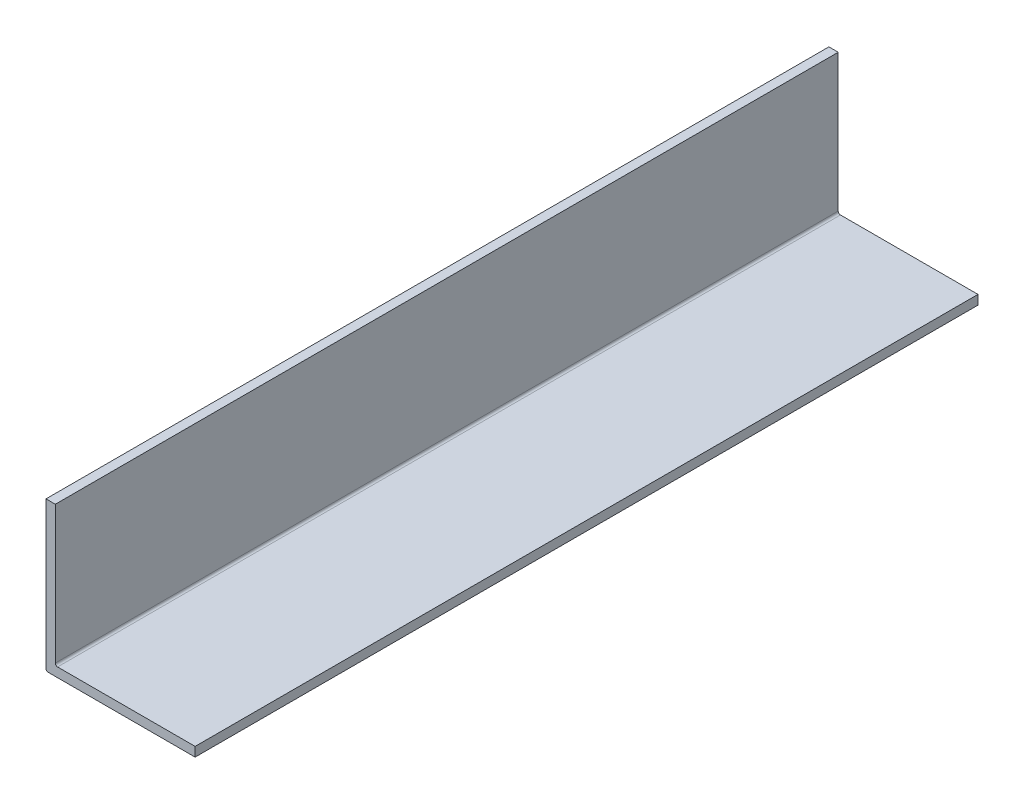
from build123d import *

# Parameters (mm, degrees)
BOSS_EXTRUDE1_DEPTH = 266.7


with BuildPart() as part:
    # Sketch1 → Boss-Extrude1 (new body)
    with BuildSketch(Plane.XY):
        with BuildLine():
            Line((3.175, 50.8), (3.175, 3.937))
            ThreePointArc((3.175, 3.937), (3.398184633, 3.398184633), (3.937, 3.175))
            Line((3.937, 3.175), (50.8, 3.175))
            Line((50.8, 3.175), (50.8, 0))
            Line((50.8, 0), (0.762, 0))
            ThreePointArc((0.762, 0), (0.223184633, 0.223184633), (0, 0.762))
            Line((0, 0.762), (0, 50.8))
            Line((0, 50.8), (3.175, 50.8))
        make_face()
    extrude(amount=BOSS_EXTRUDE1_DEPTH)


solid = part.part
